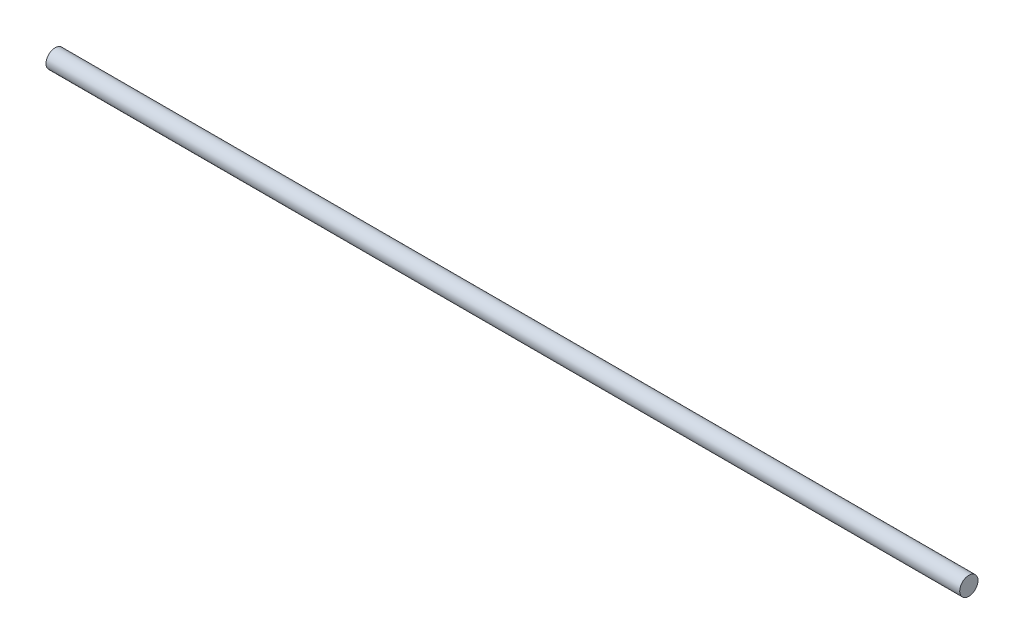
from build123d import *

# Parameters (mm, degrees)
SKETCH1_R           = 0.5
BOSS_EXTRUDE1_DEPTH = 50


with BuildPart() as part:
    # Sketch1 → Boss-Extrude1 (new body)
    with BuildSketch(Plane(origin=(0, 0, 0), x_dir=(0, 0, -1), z_dir=(1, 0, 0))):
        Circle(SKETCH1_R)
    extrude(amount=BOSS_EXTRUDE1_DEPTH)


solid = part.part
